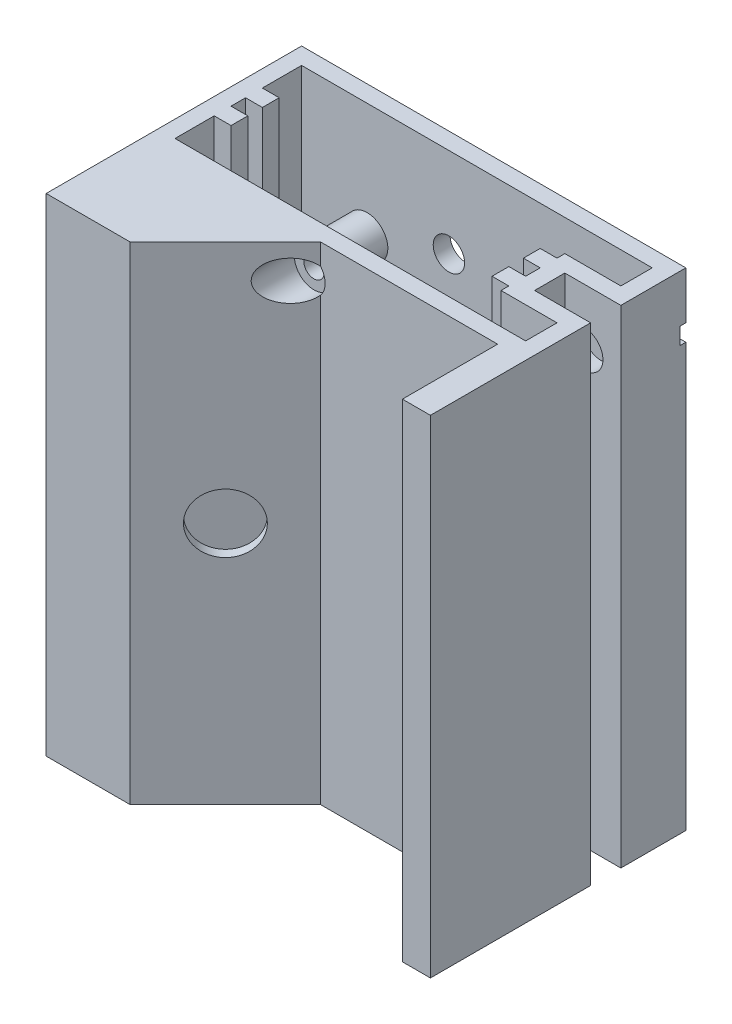
from build123d import *

# Parameters (mm, degrees)
BOSS_EXTRUDE2_DEPTH = 87
SHELL2_T            = -3
SKETCH3_W           = 3
SKETCH3_H           = 3
BOSS_EXTRUDE3_DEPTH = 84
CUT_EXTRUDE1_REACH  = 106.538
SKETCH4_R           = 3.3
CUT_EXTRUDE2_REACH  = 107.796
SKETCH5_R           = 6.3
SKETCH5_R_2         = 2.8
BOSS_EXTRUDE4_DEPTH = 84
CUT_EXTRUDE3_REACH  = 102.465
SKETCH7_W           = 7.5
SKETCH7_H           = 3.7
SKETCH8_R           = 3.7
BOSS_EXTRUDE5_DEPTH = 8
SKETCH9_R           = 1.8
CUT_EXTRUDE4_DEPTH  = 11
SKETCH10_R          = 5.3
CUT_EXTRUDE5_DEPTH  = 1.8
SKETCH11_R          = 5.3
CUT_EXTRUDE6_DEPTH  = 1.8
CUT_EXTRUDE7_REACH  = 101.657
SKETCH15_R          = 3.5
CUT_EXTRUDE8_START  = -1.5
SKETCH17_R          = 3.5
CUT_EXTRUDE8_DEPTH  = 1.5
SKETCH18_W          = 68.6
SKETCH18_H          = 3
CUT_EXTRUDE9_DEPTH  = 1
SKETCH31_W          = 3
SKETCH31_H          = 8.317693095
BOSS_EXTRUDE6_DEPTH = 8
CUT_EXTRUDE10_DEPTH = 3


with BuildPart() as part:
    # Sketch1 → Boss-Extrude2 (new body)
    with BuildSketch(Plane(origin=(0, 0, 0), x_dir=(1, 0, 0), z_dir=(0, 1, 0))):
        Polygon((-29.3, 14.3), (-29.3, -31.3), (-14.3, -31.3), (2.7, -14.3), (34.3, -14.3), (34.3, -31.3), (39.3, -31.3), (39.3, -2.7), (29.3, -2.7), (29.3, 2.7), (39.3, 2.7), (39.3, 14.3), align=None)
    extrude(amount=BOSS_EXTRUDE2_DEPTH)

    # Shell2
    shell2_openings = [part.faces().sort_by_distance(p)[0] for p in [
        (1.788570481, 87, 4.446127974),
    ]]
    offset(amount=SHELL2_T, openings=shell2_openings, kind=Kind.INTERSECTION)

    # Sketch3 → Boss-Extrude3 (add)
    with BuildSketch(Plane(origin=(0, 3, 0), x_dir=(1, 0, 0), z_dir=(0, 1, 0))):
        with Locations((24.8, 2.8)):
            Rectangle(SKETCH3_W, SKETCH3_H)
        with Locations((24.8, -2.8)):
            Rectangle(SKETCH3_W, SKETCH3_H)
        with Locations((-24.8, -2.8)):
            Rectangle(SKETCH3_W, SKETCH3_H)
        with Locations((-24.8, 2.8)):
            Rectangle(SKETCH3_W, SKETCH3_H)
    extrude(amount=BOSS_EXTRUDE3_DEPTH)

    # Cut-Extrude1: up to this face of the body (flat: up to its plane)
    cut_extrude1_end = Plane(part.part.faces().sort_by_distance((31.3, 45, 5.7))[0])
    # Sketch4 → Cut-Extrude1 (cut, up to the picked face)
    with BuildSketch(Plane.XY.offset(-11.3), mode=Mode.PRIVATE) as cut_extrude1_sk1:
        with Locations(Location((32.8, 77, 0), (0, 0, 180))):
            Circle(SKETCH4_R)
    cut_extrude1_tool1 = split(extrude(cut_extrude1_sk1.sketch, amount=CUT_EXTRUDE1_REACH, mode=Mode.PRIVATE), bisect_by=cut_extrude1_end, keep=Keep.BOTH, mode=Mode.PRIVATE)
    add(cut_extrude1_tool1.solids().sort_by(Axis((32.8, 77, -11.3), (0, 0, 1)))[0], mode=Mode.SUBTRACT)

    # Sketch5 → Cut-Extrude2 (cut, up to next)
    with BuildSketch(Plane(origin=(0, 0, -14.3), x_dir=(-1, 0, 0), z_dir=(0, 0, -1)), mode=Mode.PRIVATE) as cut_extrude2_sk1:
        with Locations((0, 55)):
            Circle(SKETCH5_R)
    cut_extrude2_tool1 = extrude(cut_extrude2_sk1.sketch, amount=-CUT_EXTRUDE2_REACH, mode=Mode.PRIVATE) & part.part
    # Sketch5 → Cut-Extrude2 (cut, up to next)
    with BuildSketch(Plane(origin=(0, 0, -14.3), x_dir=(-1, 0, 0), z_dir=(0, 0, -1)), mode=Mode.PRIVATE) as cut_extrude2_sk2:
        with Locations((0, 71)):
            Circle(SKETCH5_R_2)
    cut_extrude2_tool2 = extrude(cut_extrude2_sk2.sketch, amount=-CUT_EXTRUDE2_REACH, mode=Mode.PRIVATE) & part.part
    add(cut_extrude2_tool1.solids().sort_by_distance((0, 55, -14.3))[0], mode=Mode.SUBTRACT)
    add(cut_extrude2_tool2.solids().sort_by_distance((0, 71, -14.3))[0], mode=Mode.SUBTRACT)

    # Sketch6 → Boss-Extrude4 (add)
    with BuildSketch(Plane(origin=(0, 3, 0), x_dir=(1, 0, 0), z_dir=(0, 1, 0))):
        Polygon((1.457359313, -11.3), (-26.3, -11.3), (-26.3, -28.3), (-15.542640687, -28.3), align=None)
    extrude(amount=BOSS_EXTRUDE4_DEPTH)

    # Sketch7 → Cut-Extrude3 (cut, up to next)
    with BuildSketch(Plane.XZ, mode=Mode.PRIVATE) as cut_extrude3_sk1:
        with Locations((0, -7.15)):
            Rectangle(SKETCH7_W, SKETCH7_H)
    cut_extrude3_tool1 = extrude(cut_extrude3_sk1.sketch, amount=-CUT_EXTRUDE3_REACH, mode=Mode.PRIVATE) & part.part
    add(cut_extrude3_tool1.solids().sort_by_distance((0, 0, -7.15))[0], mode=Mode.SUBTRACT)

    # Sketch8 → Boss-Extrude5 (add)
    with BuildSketch(Plane(origin=(0, 0, 11.3), x_dir=(-1, 0, 0), z_dir=(0, 0, -1))):
        with Locations((0, 81)):
            Circle(SKETCH8_R)
    extrude(amount=BOSS_EXTRUDE5_DEPTH)

    # Sketch9 → Cut-Extrude4 (cut)
    with BuildSketch(Plane(origin=(0, 0, 3.3), x_dir=(-1, 0, 0), z_dir=(0, 0, -1))):
        with Locations((0, 81)):
            Circle(SKETCH9_R)
    extrude(amount=-CUT_EXTRUDE4_DEPTH, mode=Mode.SUBTRACT)

    # Sketch10 → Cut-Extrude5 (cut)
    with BuildSketch(Plane(origin=(8.5, 0, 8.5), x_dir=(0.7071067811865475, 0, -0.7071067811865476), z_dir=(0.7071067811865476, 0, 0.7071067811865475))):
        with Locations((-20.223253942, 43.5)):
            Circle(SKETCH10_R)
    extrude(amount=-CUT_EXTRUDE5_DEPTH, mode=Mode.SUBTRACT)

    # Sketch11 → Cut-Extrude6 (cut)
    with BuildSketch(Plane.ZY.offset(-34.3)):
        with Locations((22.8, 43.5)):
            Circle(SKETCH11_R)
    extrude(amount=-CUT_EXTRUDE6_DEPTH, mode=Mode.SUBTRACT)

    # Cut-Extrude7: up to this face of the body (flat: up to its plane)
    cut_extrude7_end = Plane(part.part.faces().sort_by_distance((-13.661760233, 43.5, 30.661760233))[0])
    # Sketch15 → Cut-Extrude7 (cut, up to the picked face)
    with BuildSketch(Plane(origin=(0, 0, 14.3), x_dir=(-1, 0, 0), z_dir=(0, 0, -1)), mode=Mode.PRIVATE) as cut_extrude7_sk1:
        with Locations((0, 81)):
            Circle(SKETCH15_R)
    cut_extrude7_tool1 = split(extrude(cut_extrude7_sk1.sketch, amount=-CUT_EXTRUDE7_REACH, mode=Mode.PRIVATE), bisect_by=cut_extrude7_end, keep=Keep.BOTH, mode=Mode.PRIVATE)
    add(cut_extrude7_tool1.solids().sort_by(Axis((0, 81, 14.3), (0, 0, 1)))[0], mode=Mode.SUBTRACT)

    # Sketch17 → Cut-Extrude8 (cut)
    with BuildSketch(Plane.XY.offset(14.3).offset(CUT_EXTRUDE8_START)):
        with Locations(Location((0, 81, 0), (0, 0, 39.517652797))):
            Circle(SKETCH17_R)
    extrude(amount=CUT_EXTRUDE8_DEPTH, mode=Mode.SUBTRACT)

    # Sketch18 → Cut-Extrude9 (cut)
    with BuildSketch(Plane(origin=(0, 0, -14.3), x_dir=(-1, 0, 0), z_dir=(0, 0, -1))):
        with Locations((-5, 77)):
            Rectangle(SKETCH18_W, SKETCH18_H)
    extrude(amount=-CUT_EXTRUDE9_DEPTH, mode=Mode.SUBTRACT)

    # Sketch31 → Boss-Extrude6 (add)
    with BuildSketch(Plane(origin=(0, 0, 11.3), x_dir=(-1, 0, 0), z_dir=(0, 0, -1))):
        with Locations((0, 73.458846548)):
            Rectangle(SKETCH31_W, SKETCH31_H)
    extrude(amount=BOSS_EXTRUDE6_DEPTH)

    # Sketch32 → Cut-Extrude10 (cut)
    with BuildSketch(Plane(origin=(1.5, 0, 0), x_dir=(0, 0, -1), z_dir=(1, 0, 0))):
        Polygon((-11.3, 69.3), (-3.3, 77.617693095), (-3.3, 69.3), align=None)
    extrude(amount=-CUT_EXTRUDE10_DEPTH, mode=Mode.SUBTRACT)


solid = part.part
